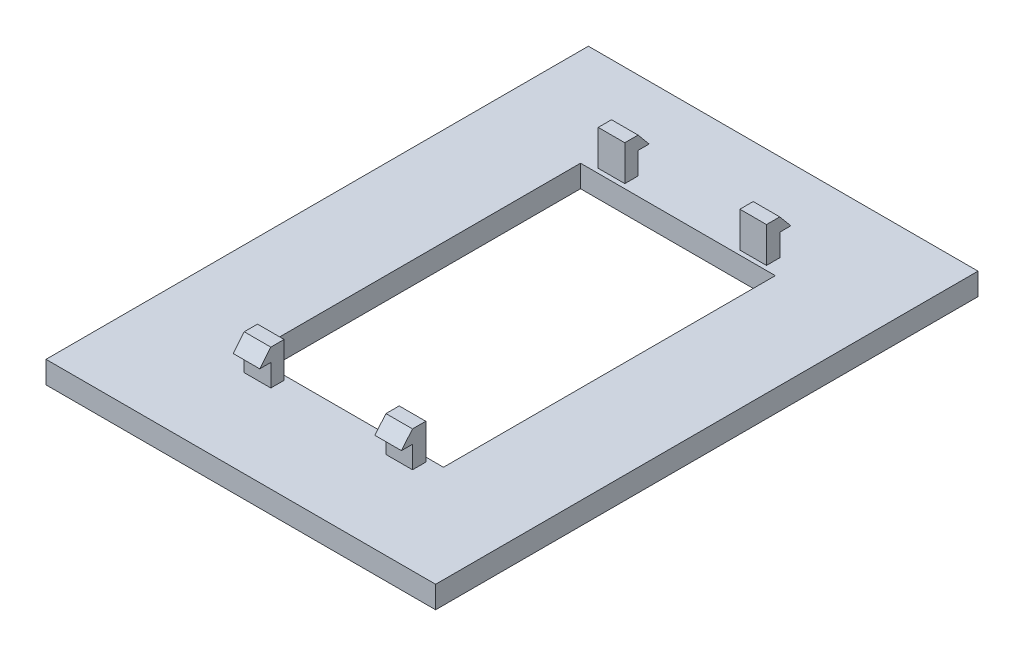
from build123d import *

# Parameters (mm, degrees)
CROQUIS1_W              = 88
CROQUIS1_H              = 122.5
SALIENTE_EXTRUIR1_DEPTH = 5
CROQUIS2_W              = 44
CROQUIS2_H              = 74.95
CORTAR_EXTRUIR1_DEPTH   = 5
CROQUIS3_W              = 3
CROQUIS3_H              = 3
SALIENTE_EXTRUIR7_DEPTH = 8
SALIENTE_EXTRUIR8_DEPTH = 38
CROQUIS6_W              = 26
CROQUIS6_H              = 87.95
CORTAR_EXTRUIR3_DEPTH   = 19


with BuildPart() as part:
    # Croquis1 → Saliente-Extruir1 (new body)
    with BuildSketch(Plane(origin=(0, 0, 0), x_dir=(1, 0, 0), z_dir=(0, 1, 0))):
        Rectangle(CROQUIS1_W, CROQUIS1_H)
    extrude(amount=SALIENTE_EXTRUIR1_DEPTH)

    # Croquis2 → Cortar-Extruir1 (cut)
    with BuildSketch(Plane(origin=(0, 5, 0), x_dir=(1, 0, 0), z_dir=(0, 1, 0))):
        Rectangle(CROQUIS2_W, CROQUIS2_H)
    extrude(amount=-CORTAR_EXTRUIR1_DEPTH, mode=Mode.SUBTRACT)

    # Croquis3 → Saliente-Extruir7 (add)
    with BuildSketch(Plane(origin=(0, 5, 0), x_dir=(1, 0, 0), z_dir=(0, 1, 0))):
        with Locations((-14.5, 39.975)):
            Rectangle(CROQUIS3_W, CROQUIS3_H)
        with Locations((-17.5, 39.975)):
            Rectangle(CROQUIS3_W, CROQUIS3_H)
        with Locations((17.5, 39.975)):
            Rectangle(CROQUIS3_W, CROQUIS3_H)
        with Locations((14.5, 39.975)):
            Rectangle(CROQUIS3_W, CROQUIS3_H)
        with Locations((-14.5, -39.975)):
            Rectangle(CROQUIS3_W, CROQUIS3_H)
        with Locations((-17.5, -39.975)):
            Rectangle(CROQUIS3_W, CROQUIS3_H)
        with Locations((17.5, -39.975)):
            Rectangle(CROQUIS3_W, CROQUIS3_H)
        with Locations((14.5, -39.975)):
            Rectangle(CROQUIS3_W, CROQUIS3_H)
    extrude(amount=SALIENTE_EXTRUIR7_DEPTH)

    # Croquis5 → Saliente-Extruir8 (add)
    with BuildSketch(Plane.ZY.offset(19)):
        Polygon((-41.475, 13), (-41.475, 10), (-43.975, 10), align=None)
        Polygon((43.975, 10), (41.475, 13), (41.475, 10), align=None)
    extrude(amount=-SALIENTE_EXTRUIR8_DEPTH)

    # Croquis6 → Cortar-Extruir3 (cut)
    with BuildSketch(Plane(origin=(0, 5, 0), x_dir=(1, 0, 0), z_dir=(0, 1, 0))):
        Rectangle(CROQUIS6_W, CROQUIS6_H)
    extrude(amount=CORTAR_EXTRUIR3_DEPTH, mode=Mode.SUBTRACT)


solid = part.part
